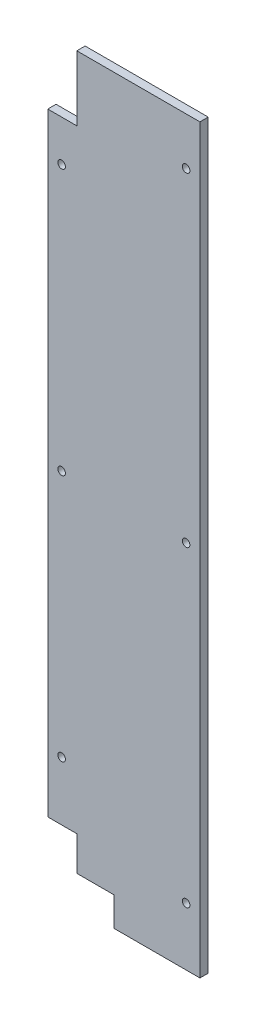
from build123d import *

# Parameters (mm, degrees)
BOSS_EXTRUDE1_DEPTH = 6
SKETCH2_R           = 2.75
CUT_EXTRUDE1_DEPTH  = 10


with BuildPart() as part:
    # Sketch1 → Boss-Extrude1 (new body)
    with BuildSketch(Plane.XY):
        Polygon((-82.419020993, -326.855738356), (-82.419020993, -305.855738356), (-109.419020993, -305.855738356), (-109.419020993, -281.0269235), (-130.419020993, -281.0269235), (-130.419020993, 162.175301007), (-109.419020993, 162.175301007), (-109.419020993, 209.144261644), (-20.419020993, 209.144261644), (-20.419020993, -326.855738356), align=None)
    extrude(amount=BOSS_EXTRUDE1_DEPTH)

    # Sketch2 → Cut-Extrude1 (cut)
    with BuildSketch(Plane.XY.offset(6)):
        with Locations((-120.419020993, -59.425811246)):
            Circle(SKETCH2_R)
        with Locations((-30.419020993, -59.425811246)):
            Circle(SKETCH2_R)
        with Locations((-30.419020993, 174.944215352)):
            Circle(SKETCH2_R)
        with Locations((-30.419020993, -284.937648356)):
            Circle(SKETCH2_R)
        with Locations((-120.419020993, -238.562803654)):
            Circle(SKETCH2_R)
        with Locations((-120.419020993, 132.455525643)):
            Circle(SKETCH2_R)
    extrude(amount=-CUT_EXTRUDE1_DEPTH, mode=Mode.SUBTRACT)


solid = part.part
